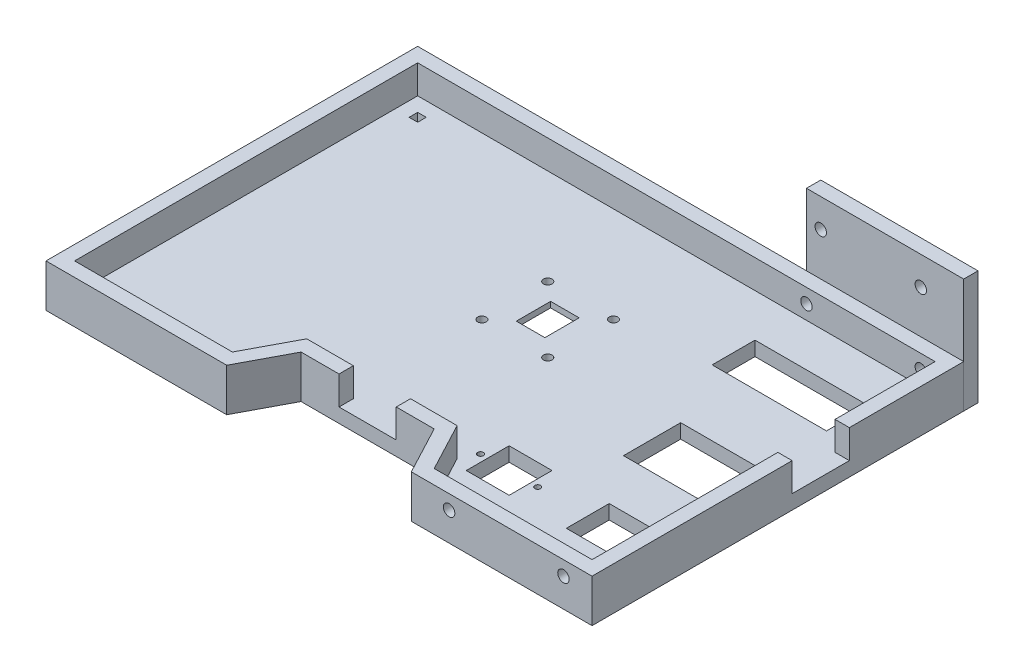
from build123d import *

# Parameters (mm, degrees)
BOSS_EXTRUDE2_DEPTH     = 15
SHELL1_T                = -5
CUT_EXTRUDE2_DEPTH      = 117.491415993
CUT_EXTRUDE2_DEPTH_BACK = 117.491415993
SKETCH4_R               = 1
SKETCH4_W               = 10
SKETCH4_H               = 12
SKETCH4_W_2             = 27
SKETCH4_H_2             = 20
SKETCH4_W_3             = 15
SKETCH4_H_3             = 15
SKETCH4_W_4             = 40
SKETCH5_W               = 3
SKETCH5_H               = 3
CUT_EXTRUDE4_DEPTH      = 117.491415993
SKETCH6_W               = 55
SKETCH6_H               = 40
SKETCH6_R               = 2
BOSS_EXTRUDE3_DEPTH     = 5
CUT_EXTRUDE5_DEPTH      = 171.133036181
CUT_EXTRUDE5_DEPTH_BACK = 171.133036181
SKETCH7_R               = 2
CHAMFER2_SIZE           = 3
SKETCH10_R              = 1.5
CUT_EXTRUDE6_DEPTH      = 5
SKETCH11_W              = 20
SKETCH11_H              = 10
CUT_EXTRUDE7_DEPTH      = 5
SKETCH12_W              = 20
SKETCH12_H              = 15
CUT_EXTRUDE8_DEPTH      = 6


with BuildPart() as part:
    # Sketch3 → Boss-Extrude2 (new body)
    with BuildSketch(Plane(origin=(0, 0, 0), x_dir=(1, 0, 0), z_dir=(0, 1, 0))):
        Polygon((95.5, 65), (-95.5, 65), (-95.5, -65), (-32.285430092, -65), (-23.285430092, -48), (23.285430092, -48), (32.285430092, -65), (95.5, -65), align=None)
    extrude(amount=BOSS_EXTRUDE2_DEPTH)

    # Shell1
    shell1_openings = [part.faces().sort_by_distance(p)[0] for p in [
        (0, 15, -2.252821678),
    ]]
    offset(amount=SHELL1_T, openings=shell1_openings, kind=Kind.INTERSECTION)

    # Sketch4 → Cut-Extrude2 (cut, two sides: drawn at the far end of the back side and taken through both)
    with BuildSketch(Plane(origin=(0, 0, 0), x_dir=(1, 0, 0), z_dir=(0, 1, 0)).offset(-CUT_EXTRUDE2_DEPTH_BACK)):
        with Locations((29, -37.5)):
            Circle(SKETCH4_R)
        with Locations((49, -37.5)):
            Circle(SKETCH4_R)
        with Locations((0, 15)):
            Rectangle(SKETCH4_W, SKETCH4_H)
        with Locations((68, -3)):
            Rectangle(SKETCH4_W_2, SKETCH4_H_2)
        with Locations((74, -37.5)):
            Rectangle(SKETCH4_W_3, SKETCH4_H_3)
        with Locations((39, -37.5)):
            Rectangle(SKETCH4_W_3, SKETCH4_H_3)
        with Locations((62.5, 37.5)):
            Rectangle(SKETCH4_W_4, SKETCH4_H_3)
    extrude(amount=CUT_EXTRUDE2_DEPTH + CUT_EXTRUDE2_DEPTH_BACK, mode=Mode.SUBTRACT)

    # Sketch5 → Cut-Extrude4 (cut, through all)
    with BuildSketch(Plane(origin=(0, 0, 0), x_dir=(1, 0, 0), z_dir=(0, 1, 0))):
        with Locations((-84, 53.5)):
            Rectangle(SKETCH5_W, SKETCH5_H)
        with Locations((84, 53.5)):
            Rectangle(SKETCH5_W, SKETCH5_H)
        with Locations((84, -53.5)):
            Rectangle(SKETCH5_W, SKETCH5_H)
        with Locations((-84, -53.5)):
            Rectangle(SKETCH5_W, SKETCH5_H)
    extrude(amount=CUT_EXTRUDE4_DEPTH, mode=Mode.SUBTRACT)


with BuildPart() as body_2:
    # Sketch6 → Boss-Extrude3 (new body)
    with BuildSketch(Plane(origin=(0, 0, -65), x_dir=(-1, 0, 0), z_dir=(0, 0, -1))):
        with Locations((-68, 20)):
            Rectangle(SKETCH6_W, SKETCH6_H)
        with Locations((-80.5, 30)):
            Circle(SKETCH6_R, mode=Mode.SUBTRACT)
        with Locations((-45.5, 30)):
            Circle(SKETCH6_R, mode=Mode.SUBTRACT)
    extrude(amount=BOSS_EXTRUDE3_DEPTH)


with BuildPart() as cut_extrude5_tool:
    # Sketch7 → Cut-Extrude5 (new, two sides: drawn at the far end of the back side and taken through both)
    with BuildSketch(Plane(origin=(0, 0, -70), x_dir=(-1, 0, 0), z_dir=(0, 0, -1)).offset(-CUT_EXTRUDE5_DEPTH_BACK)):
        with Locations((-85.5, 10)):
            Circle(SKETCH7_R)
        with Locations((-45.5, 10)):
            Circle(SKETCH7_R)
    extrude(amount=CUT_EXTRUDE5_DEPTH + CUT_EXTRUDE5_DEPTH_BACK)


with BuildPart() as part_1:
    add(part.part)

    # Cut-Extrude5: cut by cut_extrude5_tool
    add(cut_extrude5_tool.part, mode=Mode.SUBTRACT)

    # Chamfer2
    chamfer2_edges = [part_1.edges().sort_by_distance(p)[0] for p in [
        (0, 0, -21),
        (5, 0, -15),
        (0, 0, -9),
        (-5, 0, -15),
    ]]
    chamfer(chamfer2_edges, length=CHAMFER2_SIZE)

    # Sketch10 → Cut-Extrude6 (cut)
    with BuildSketch(Plane.XZ):
        with Locations((11.5, -3.5)):
            Circle(SKETCH10_R)
        with Locations((11.5, -26.5)):
            Circle(SKETCH10_R)
        with Locations((-11.5, -26.5)):
            Circle(SKETCH10_R)
        with Locations((-11.5, -3.5)):
            Circle(SKETCH10_R)
    extrude(amount=-CUT_EXTRUDE6_DEPTH, mode=Mode.SUBTRACT)

    # Sketch11 → Cut-Extrude7 (cut)
    with BuildSketch(Plane.XY.offset(48)):
        with Locations((0, 10)):
            Rectangle(SKETCH11_W, SKETCH11_H)
    extrude(amount=-CUT_EXTRUDE7_DEPTH, mode=Mode.SUBTRACT)

    # Sketch12 → Cut-Extrude8 (cut)
    with BuildSketch(Plane(origin=(95.5, 0, 0), x_dir=(0, 0, -1), z_dir=(1, 0, 0))):
        with Locations((15, 12.5)):
            Rectangle(SKETCH12_W, SKETCH12_H)
    extrude(amount=-CUT_EXTRUDE8_DEPTH, mode=Mode.SUBTRACT)


with BuildPart() as body_2_1:
    add(body_2.part)

    # Cut-Extrude5: cut by cut_extrude5_tool
    add(cut_extrude5_tool.part, mode=Mode.SUBTRACT)


solid = Compound([part_1.part, body_2_1.part])
